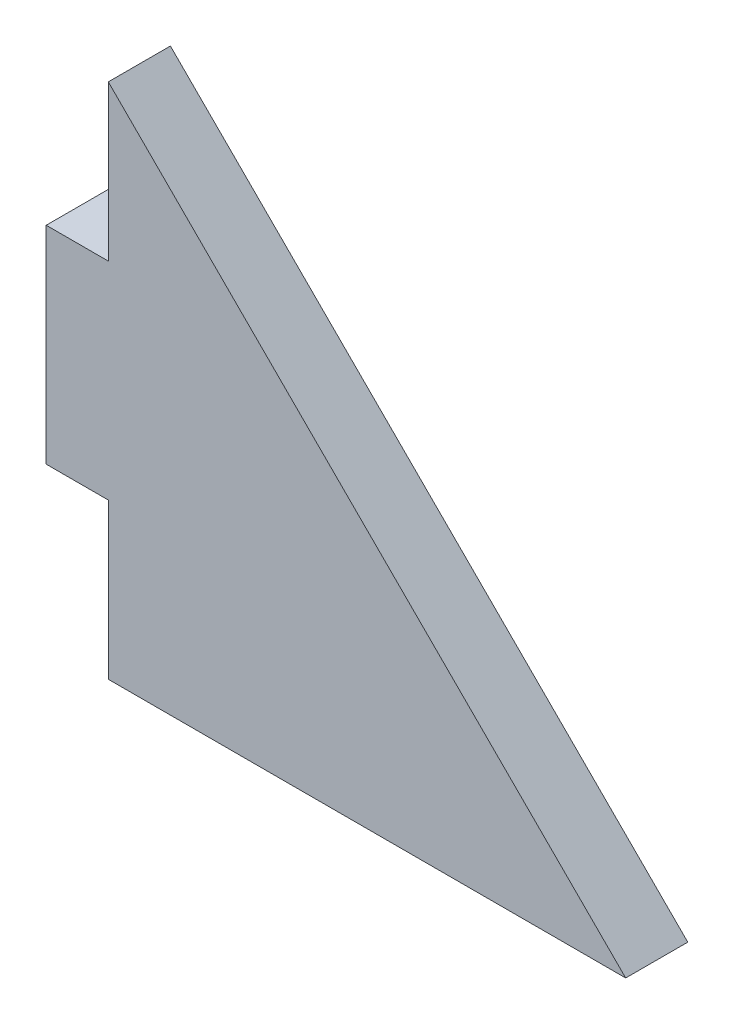
from build123d import *

# Parameters (mm, degrees)
BOSS_EXTRUDE1_DEPTH = 3


with BuildPart() as part:
    # Sketch1 → Boss-Extrude1 (new body)
    with BuildSketch(Plane.XY):
        Polygon((0, 0), (0, 7.5), (-3, 7.5), (-3, 17.5), (0, 17.5), (0, 25), (25, 0), align=None)
    extrude(amount=BOSS_EXTRUDE1_DEPTH)


solid = part.part
